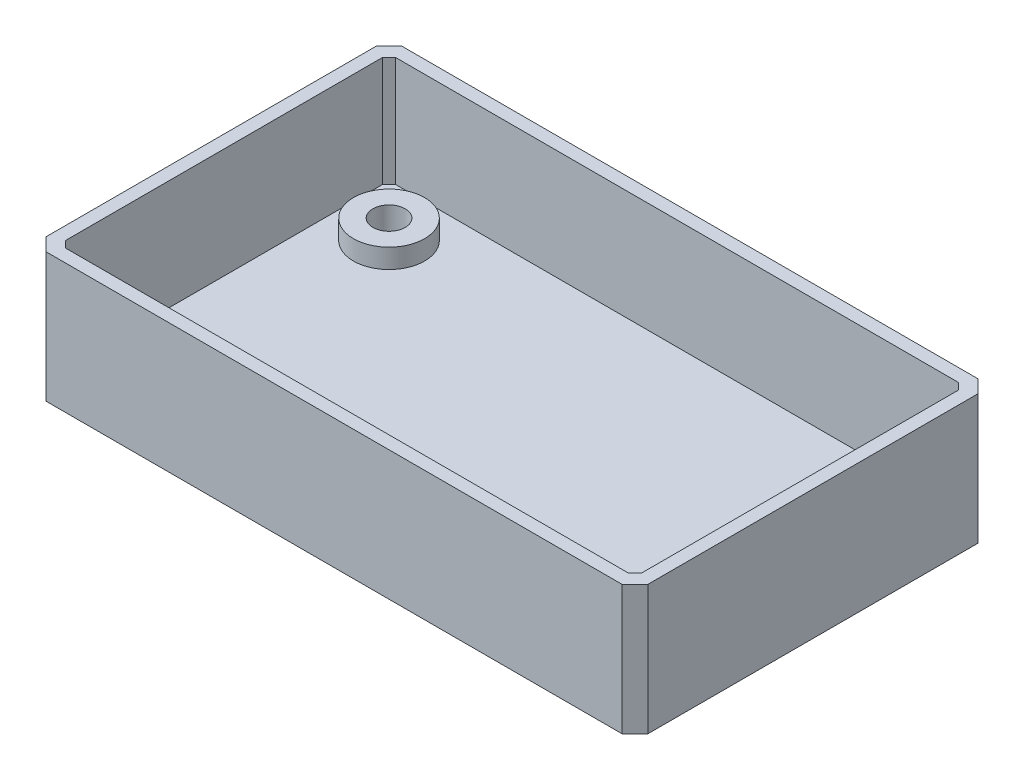
from build123d import *

# Parameters (mm, degrees)
SKETCH1_W           = 89
SKETCH1_H           = 51
SKETCH1_R           = 2.5
BOSS_EXTRUDE1_DEPTH = 3
SKETCH2_R           = 5.5
SKETCH2_R_2         = 2.5
BOSS_EXTRUDE2_DEPTH = 3
SKETCH3_W           = 93
SKETCH3_H           = 55
SKETCH3_W_2         = 89
SKETCH3_H_2         = 51
BOSS_EXTRUDE3_DEPTH = 20
CHAMFER1_SIZE       = 2
CHAMFER2_SIZE       = 1


with BuildPart() as part:
    # Sketch1 → Boss-Extrude1 (new body)
    with BuildSketch(Plane(origin=(0, 0, 0), x_dir=(1, 0, 0), z_dir=(0, 1, 0))):
        with Locations((36.5, -17.5)):
            Rectangle(SKETCH1_W, SKETCH1_H)
        with Locations(Location((0, 0, 0), (0, 0, 270))):
            Circle(SKETCH1_R, mode=Mode.SUBTRACT)
        with Locations(Location((73, 0, 0), (0, 0, 270))):
            Circle(SKETCH1_R, mode=Mode.SUBTRACT)
        with Locations(Location((0, -35, 0), (0, 0, 270))):
            Circle(SKETCH1_R, mode=Mode.SUBTRACT)
        with Locations(Location((73, -35, 0), (0, 0, 270))):
            Circle(SKETCH1_R, mode=Mode.SUBTRACT)
    extrude(amount=BOSS_EXTRUDE1_DEPTH)

    # Sketch2 → Boss-Extrude2 (add)
    # profile 1 of 4: a face of its own
    with BuildSketch(Plane(origin=(0, 3, 0), x_dir=(1, 0, 0), z_dir=(0, 1, 0))):
        with Locations(Location((0, 0, 0), (0, 0, 270))):
            Circle(SKETCH2_R)
        with Locations(Location((0, 0, 0), (0, 0, 270))):
            Circle(SKETCH2_R_2, mode=Mode.SUBTRACT)
    # profile 2 of 4: a face of its own
    with BuildSketch(Plane(origin=(0, 3, 0), x_dir=(1, 0, 0), z_dir=(0, 1, 0))):
        with Locations(Location((73, 0, 0), (0, 0, 270))):
            Circle(SKETCH2_R)
        with Locations(Location((73, 0, 0), (0, 0, 270))):
            Circle(SKETCH2_R_2, mode=Mode.SUBTRACT)
    # profile 3 of 4: a face of its own
    with BuildSketch(Plane(origin=(0, 3, 0), x_dir=(1, 0, 0), z_dir=(0, 1, 0))):
        with Locations(Location((73, -35, 0), (0, 0, 270))):
            Circle(SKETCH2_R)
        with Locations(Location((73, -35, 0), (0, 0, 270))):
            Circle(SKETCH2_R_2, mode=Mode.SUBTRACT)
    # profile 4 of 4: a face of its own
    with BuildSketch(Plane(origin=(0, 3, 0), x_dir=(1, 0, 0), z_dir=(0, 1, 0))):
        with Locations(Location((0, -35, 0), (0, 0, 270))):
            Circle(SKETCH2_R)
        with Locations(Location((0, -35, 0), (0, 0, 270))):
            Circle(SKETCH2_R_2, mode=Mode.SUBTRACT)
    extrude(amount=BOSS_EXTRUDE2_DEPTH)

    # Sketch3 → Boss-Extrude3 (add)
    with BuildSketch(Plane.XZ):
        with Locations((36.5, 17.5)):
            Rectangle(SKETCH3_W, SKETCH3_H)
        with Locations((36.5, 17.5)):
            Rectangle(SKETCH3_W_2, SKETCH3_H_2, mode=Mode.SUBTRACT)
    extrude(amount=-BOSS_EXTRUDE3_DEPTH)

    # Chamfer1
    chamfer1_edges = [part.edges().sort_by_distance(p)[0] for p in [
        (-10, 10, 45),
        (83, 10, 45),
        (83, 10, -10),
        (-10, 10, -10),
    ]]
    chamfer(chamfer1_edges, length=CHAMFER1_SIZE)

    # Chamfer2
    chamfer2_edges = [part.edges().sort_by_distance(p)[0] for p in [
        (81, 11.5, 43),
        (81, 11.5, -8),
        (-8, 11.5, -8),
        (-8, 11.5, 43),
    ]]
    chamfer(chamfer2_edges, length=CHAMFER2_SIZE)


solid = part.part
